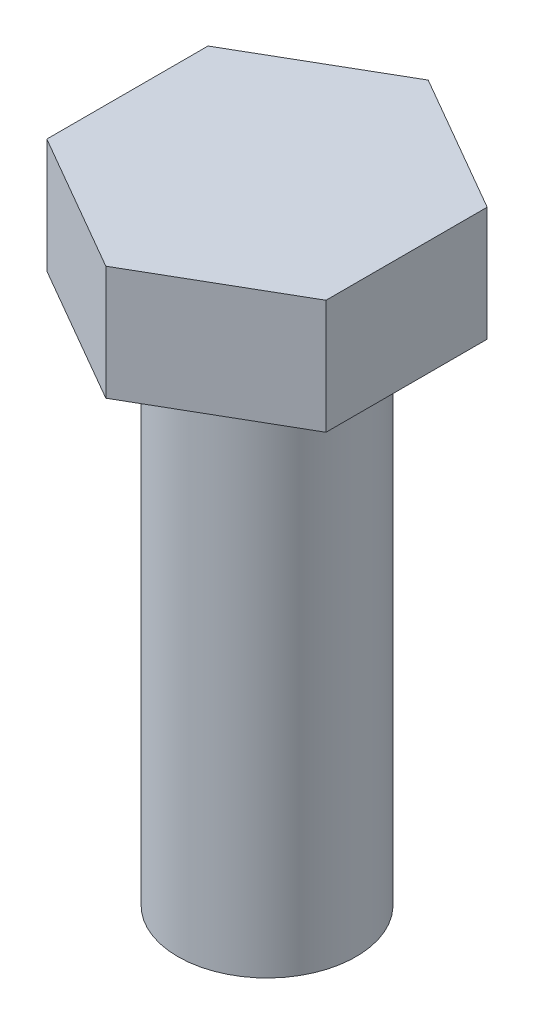
from build123d import *

# Parameters (mm, degrees)
BOSS_EXTRUDE1_DEPTH = 7.7
SKETCH2_R           = 6
BOSS_EXTRUDE2_DEPTH = 35


with BuildPart() as part:
    # Sketch1 → Boss-Extrude1 (new body)
    with BuildSketch(Plane(origin=(0, 0, 0), x_dir=(1, 0, 0), z_dir=(0, 1, 0))):
        Polygon((0, 10.854185061), (-9.4, 5.42709253), (-9.4, -5.42709253), (0, -10.854185061), (9.4, -5.42709253), (9.4, 5.42709253), align=None)
    extrude(amount=BOSS_EXTRUDE1_DEPTH)

    # Sketch2 → Boss-Extrude2 (add)
    with BuildSketch(Plane.XZ):
        with Locations(Location((0, 0, 0), (0, 0, 270))):
            Circle(SKETCH2_R)
    extrude(amount=BOSS_EXTRUDE2_DEPTH)


solid = part.part
